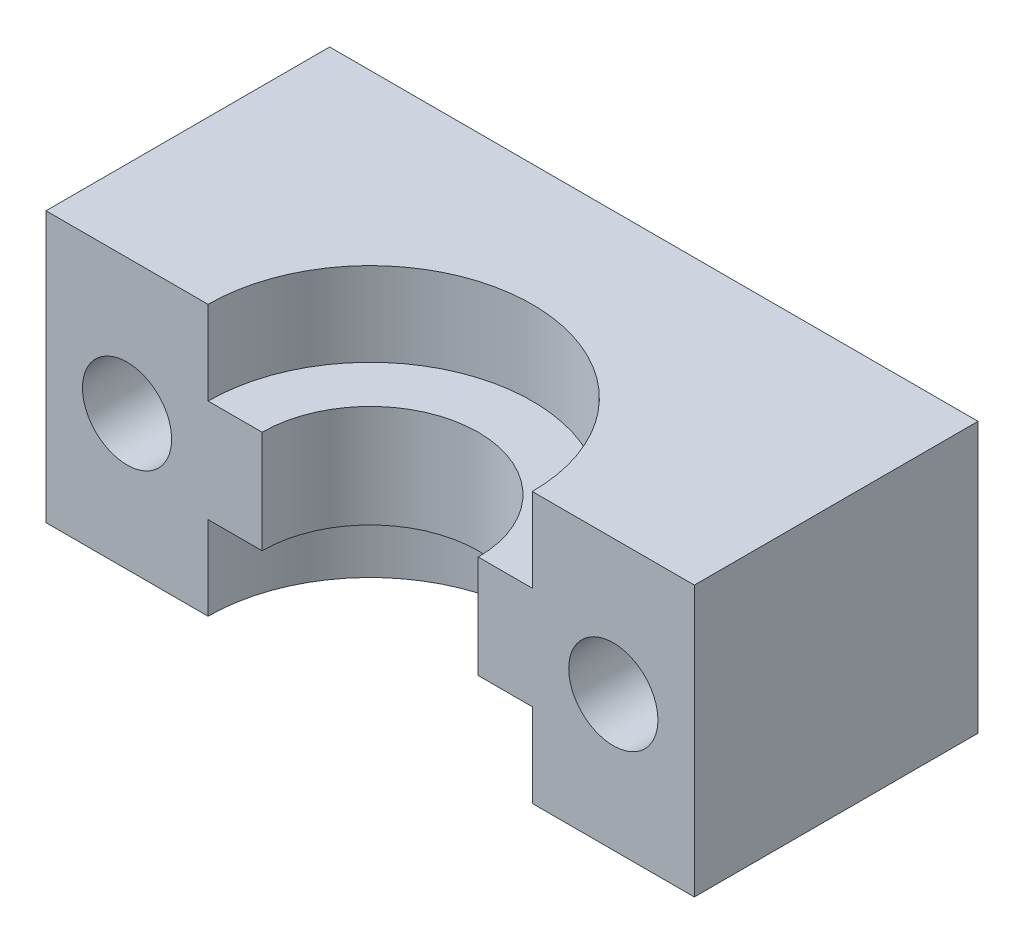
from build123d import *

# Parameters (mm, degrees)
CROQUIS1_W              = 24
CROQUIS1_H              = 10
CROQUIS1_R              = 1.65
SALIENTE_EXTRUIR1_DEPTH = 10.5


with BuildPart() as part:
    # Croquis1 → Saliente-Extruir1 (new body)
    with BuildSketch(Plane.XY):
        Rectangle(CROQUIS1_W, CROQUIS1_H)
        with Locations(Location((-9, 0, 0), (0, 0, 180))):
            Circle(CROQUIS1_R, mode=Mode.SUBTRACT)
        with Locations(Location((9, 0, 0), (0, 0, 180))):
            Circle(CROQUIS1_R, mode=Mode.SUBTRACT)
    extrude(amount=SALIENTE_EXTRUIR1_DEPTH)

    # Croquis2 → Cortar-Revolución1 (revolve, cut)
    with BuildSketch(Plane(origin=(0, 0, 0), x_dir=(0, 0, -1), z_dir=(1, 0, 0))):
        Polygon((-6.5, 1.9), (-6.5, -1.9), (-4.5, -1.9), (-4.5, -5), (-10.5, -5), (-10.5, 5), (-4.5, 5), (-4.5, 1.9), align=None)
    revolve(axis=Axis((0, 5.062819344, 10.5), (0, 1, 0)), mode=Mode.SUBTRACT)


solid = part.part
